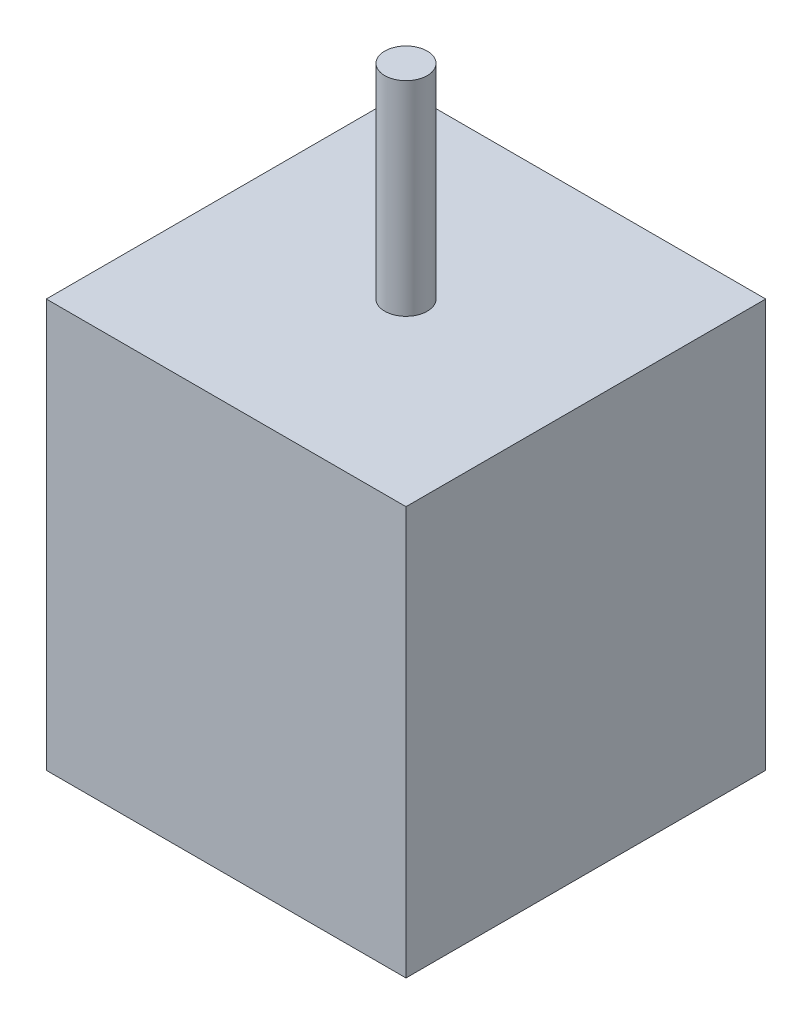
from build123d import *

# Parameters (mm, degrees)
SKETCH2_R           = 2.5
BOSS_EXTRUDE1_DEPTH = 24
SKETCH1_W           = 42.3
SKETCH1_H           = 42.3
BOSS_EXTRUDE2_DEPTH = 48


with BuildPart() as part:
    # Sketch2 → Boss-Extrude1 (new body)
    with BuildSketch(Plane(origin=(0, 0, 0), x_dir=(1, 0, 0), z_dir=(0, 1, 0))):
        with Locations(Location((0, 0, 0), (0, 0, 270))):
            Circle(SKETCH2_R)
    extrude(amount=BOSS_EXTRUDE1_DEPTH)

    # Sketch1 → Boss-Extrude2 (add)
    with BuildSketch(Plane(origin=(0, 0, 0), x_dir=(1, 0, 0), z_dir=(0, 1, 0))):
        Rectangle(SKETCH1_W, SKETCH1_H)
    extrude(amount=-BOSS_EXTRUDE2_DEPTH)


solid = part.part
